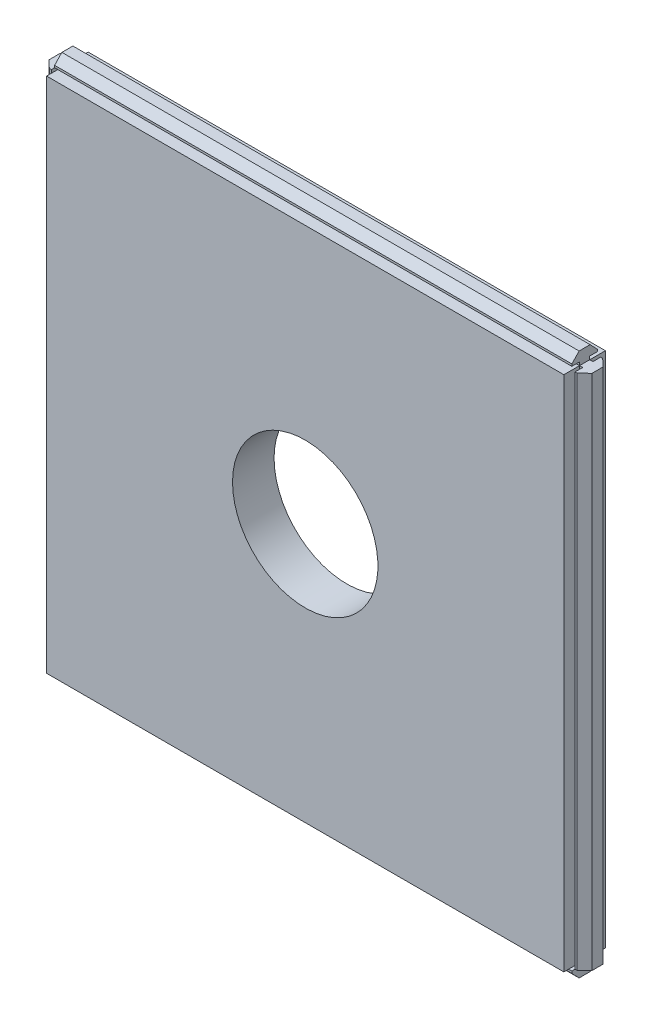
from build123d import *

# Parameters (mm, degrees)
BOSS_EXTRU_3_DEPTH            = 20
ENL_V_MAT_EXTRU_11_DEPTH      = 295.374154069
ENL_V_MAT_EXTRU_11_DEPTH_BACK = 249
ENL_V_MAT_EXTRU_12_DEPTH      = 295.374154069
ENL_V_MAT_EXTRU_12_DEPTH_BACK = 249
ENL_V_MAT_EXTRU_13_DEPTH      = 372.52143865
ENL_V_MAT_EXTRU_13_DEPTH_BACK = 249
ENL_V_MAT_EXTRU_14_DEPTH      = 372.52143865
ENL_V_MAT_EXTRU_14_DEPTH_BACK = 249
ENL_V_MAT_EXTRU_15_DEPTH      = 295.374154069
ENL_V_MAT_EXTRU_15_DEPTH_BACK = 249
ENL_V_MAT_EXTRU_16_DEPTH      = 295.374154069
ENL_V_MAT_EXTRU_16_DEPTH_BACK = 249
ENL_V_MAT_EXTRU_17_DEPTH      = 372.52143865
ENL_V_MAT_EXTRU_17_DEPTH_BACK = 249
ENL_V_MAT_EXTRU_18_DEPTH      = 372.52143865
ENL_V_MAT_EXTRU_18_DEPTH_BACK = 249
ESQUISSE17_R                  = 35
ENL_V_MAT_EXTRU_20_DEPTH      = 20


with BuildPart() as part:
    # Esquisse1 → Boss.-Extru.3 (new body)
    with BuildSketch(Plane.XY):
        Polygon((-263.060356118, 145.358531169), (-14.060356118, 145.358531169), (-14.060356118, 139.158531169), (-7.860356118, 139.158531169), (-7.860356118, -109.841468831), (-14.060356118, -109.841468831), (-14.060356118, -116.041468831), (-263.060356118, -116.041468831), (-263.060356118, -109.841468831), (-269.260356118, -109.841468831), (-269.260356118, 139.158531169), (-263.060356118, 139.158531169), align=None)
    extrude(amount=BOSS_EXTRU_3_DEPTH)

    # Esquisse4 → Enlèv. mat.-Extru.11 (cut, two sides: drawn at the far end of the back side and taken through both)
    with BuildSketch(Plane(origin=(-14.060356118, 0, 0), x_dir=(0, 0, -1), z_dir=(1, 0, 0)).offset(-ENL_V_MAT_EXTRU_11_DEPTH_BACK)):
        Polygon((-553.411816833, 139.158531169), (-20, 139.158531169), (-12.45, 139.158531169), (-12.45, 140.708531169), (-16.15, 140.708531169), (-16.15, 141.708531169), (-12.65, 145.358531169), (356.535030531, 530.365777294), (-64.826371106, 1510.451097334), (-974.77321847, 1119.243851209), align=None)
    extrude(amount=ENL_V_MAT_EXTRU_11_DEPTH + ENL_V_MAT_EXTRU_11_DEPTH_BACK, mode=Mode.SUBTRACT)

    # Esquisse8 → Enlèv. mat.-Extru.12 (cut, two sides: drawn at the far end of the back side and taken through both)
    with BuildSketch(Plane(origin=(-14.060356118, 0, 0), x_dir=(0, 0, -1), z_dir=(1, 0, 0)).offset(-ENL_V_MAT_EXTRU_12_DEPTH_BACK)):
        Polygon((533.411816833, 139.158531169), (0, 139.158531169), (-7.55, 139.158531169), (-7.55, 140.708531169), (-3.85, 140.708531169), (-3.85, 141.708531169), (-7.35, 145.358531169), (-376.535030531, 530.365777294), (44.826371106, 1510.451097334), (954.77321847, 1119.243851209), align=None)
    extrude(amount=ENL_V_MAT_EXTRU_12_DEPTH + ENL_V_MAT_EXTRU_12_DEPTH_BACK, mode=Mode.SUBTRACT)

    # Esquisse10 → Enlèv. mat.-Extru.13 (cut, two sides: drawn at the far end of the back side and taken through both)
    with BuildSketch(Plane(origin=(0, 139.158531169, 0), x_dir=(1, 0, 0), z_dir=(0, 1, 0)).offset(-ENL_V_MAT_EXTRU_13_DEPTH_BACK)):
        Polygon((-263.060356118, -20), (-263.060356118, -12.45), (-264.610356118, -12.45), (-264.610356118, -16.15), (-265.610356118, -16.15), (-269.260356118, -12.65), (-269.260356118, -20), align=None)
    extrude(amount=ENL_V_MAT_EXTRU_13_DEPTH + ENL_V_MAT_EXTRU_13_DEPTH_BACK, mode=Mode.SUBTRACT)

    # Esquisse11 → Enlèv. mat.-Extru.14 (cut, two sides: drawn at the far end of the back side and taken through both)
    with BuildSketch(Plane(origin=(0, 139.158531169, 0), x_dir=(1, 0, 0), z_dir=(0, 1, 0)).offset(-ENL_V_MAT_EXTRU_14_DEPTH_BACK)):
        Polygon((-643.553156031, -387.393505759), (-269.260356118, -7.35), (-265.813317082, -3.85), (-264.610356118, -3.85), (-264.610356118, -7.55), (-263.060356118, -7.55), (-263.060356118, 0), (-263.060356118, 533.411816833), (-1249.023765439, 940.82907325), (-1629.516565352, 20.023750658), align=None)
    extrude(amount=ENL_V_MAT_EXTRU_14_DEPTH + ENL_V_MAT_EXTRU_14_DEPTH_BACK, mode=Mode.SUBTRACT)

    # Esquisse12 → Enlèv. mat.-Extru.15 (cut, two sides: drawn at the far end of the back side and taken through both)
    with BuildSketch(Plane.ZY.offset(263.060356118).offset(-ENL_V_MAT_EXTRU_15_DEPTH_BACK)):
        Polygon((20, -109.841468831), (12.45, -109.841468831), (12.45, -111.391468831), (16.15, -111.391468831), (16.15, -112.391468831), (12.65, -116.041468831), (20, -116.041468831), align=None)
    extrude(amount=ENL_V_MAT_EXTRU_15_DEPTH + ENL_V_MAT_EXTRU_15_DEPTH_BACK, mode=Mode.SUBTRACT)

    # Esquisse13 → Enlèv. mat.-Extru.16 (cut, two sides: drawn at the far end of the back side and taken through both)
    with BuildSketch(Plane.ZY.offset(263.060356118).offset(-ENL_V_MAT_EXTRU_16_DEPTH_BACK)):
        Polygon((376.535030531, -501.048714956), (7.35, -116.041468831), (3.85, -112.391468831), (3.85, -111.391468831), (7.55, -111.391468831), (7.55, -109.841468831), (0, -109.841468831), (-533.411816833, -109.841468831), (-954.77321847, -1089.92678887), (-44.826371106, -1481.134034995), align=None)
    extrude(amount=ENL_V_MAT_EXTRU_16_DEPTH + ENL_V_MAT_EXTRU_16_DEPTH_BACK, mode=Mode.SUBTRACT)

    # Esquisse15 → Enlèv. mat.-Extru.17 (cut, two sides: drawn at the far end of the back side and taken through both)
    with BuildSketch(Plane(origin=(0, 139.158531169, 0), x_dir=(1, 0, 0), z_dir=(0, 1, 0)).offset(-ENL_V_MAT_EXTRU_17_DEPTH_BACK)):
        Polygon((-14.060356118, 0), (-14.060356118, -7.55), (-12.510356118, -7.55), (-12.510356118, -3.85), (-11.510356118, -3.85), (-7.860356118, -7.35), (-7.860356118, 0), align=None)
    extrude(amount=ENL_V_MAT_EXTRU_17_DEPTH + ENL_V_MAT_EXTRU_17_DEPTH_BACK, mode=Mode.SUBTRACT)

    # Esquisse16 → Enlèv. mat.-Extru.18 (cut, two sides: drawn at the far end of the back side and taken through both)
    with BuildSketch(Plane(origin=(0, 139.158531169, 0), x_dir=(1, 0, 0), z_dir=(0, 1, 0)).offset(-ENL_V_MAT_EXTRU_18_DEPTH_BACK)):
        Polygon((377.146890007, 356.535030531), (-7.860356118, -12.65), (-11.510356118, -16.15), (-12.510356118, -16.15), (-12.510356118, -12.45), (-14.060356118, -12.45), (-14.060356118, -20), (-14.060356118, -553.411816833), (966.024963922, -974.77321847), (1357.232210047, -64.826371106), align=None)
    extrude(amount=ENL_V_MAT_EXTRU_18_DEPTH + ENL_V_MAT_EXTRU_18_DEPTH_BACK, mode=Mode.SUBTRACT)

    # Esquisse17 → Enlèv. mat.-Extru.20 (cut)
    with BuildSketch(Plane(origin=(0, 0, 0), x_dir=(-1, 0, 0), z_dir=(0, 0, -1))):
        with Locations((138.560356118, 14.658531169)):
            Circle(ESQUISSE17_R)
    extrude(amount=-ENL_V_MAT_EXTRU_20_DEPTH, mode=Mode.SUBTRACT)


solid = part.part
